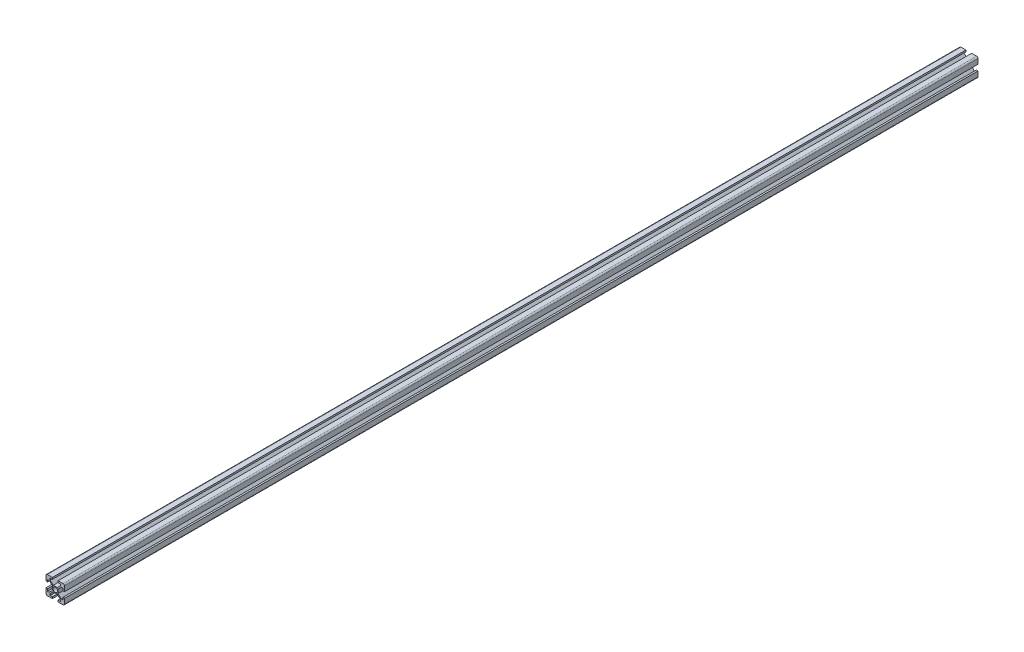
from build123d import *

# Parameters (mm, degrees)
SKETCH_1_R      = 2.5
EXTRUDE_1_DEPTH = 990


with BuildPart() as part:
    # 草图1 → 凸台-拉伸1 (new body)
    with BuildSketch(Plane.XY):
        with BuildLine():
            Line((-8.2, -3.1), (-10, -3.1))
            Line((-10, -3.1), (-10, -8.5))
            ThreePointArc((-10, -8.5), (-9.560660172, -9.560660172), (-8.5, -10))
            Line((-8.5, -10), (-3.1, -10))
            Line((-3.1, -10), (-3.1, -8.2))
            Line((-3.1, -8.2), (-5.5, -8.2))
            Line((-5.5, -8.2), (-5.5, -6.397050155))
            Line((-5.5, -6.397050155), (-2.202949845, -3.1))
            Line((-2.202949845, -3.1), (2.202949845, -3.1))
            Line((2.202949845, -3.1), (5.5, -6.397050155))
            Line((5.5, -6.397050155), (5.5, -8.2))
            Line((5.5, -8.2), (3.1, -8.2))
            Line((3.1, -8.2), (3.1, -10))
            Line((3.1, -10), (8.5, -10))
            ThreePointArc((8.5, -10), (9.560660172, -9.560660172), (10, -8.5))
            Line((10, -8.5), (10, -3.1))
            Line((10, -3.1), (8.2, -3.1))
            Line((8.2, -3.1), (8.2, -5.5))
            Line((8.2, -5.5), (6.397050155, -5.5))
            Line((6.397050155, -5.5), (3.05412702, -2.157076865))
            Line((3.05412702, -2.157076865), (3.05412702, 2.157076865))
            Line((3.05412702, 2.157076865), (6.397050155, 5.5))
            Line((6.397050155, 5.5), (8.2, 5.5))
            Line((8.2, 5.5), (8.2, 3.1))
            Line((8.2, 3.1), (10, 3.1))
            Line((10, 3.1), (10, 8.5))
            ThreePointArc((10, 8.5), (9.560660172, 9.560660172), (8.5, 10))
            Line((8.5, 10), (3.1, 10))
            Line((3.1, 10), (3.1, 8.2))
            Line((3.1, 8.2), (5.5, 8.2))
            Line((5.5, 8.2), (5.5, 6.397050155))
            Line((5.5, 6.397050155), (2.202949845, 3.1))
            Line((2.202949845, 3.1), (-2.202949845, 3.1))
            Line((-2.202949845, 3.1), (-5.5, 6.397050155))
            Line((-5.5, 6.397050155), (-5.5, 8.2))
            Line((-5.5, 8.2), (-3.1, 8.2))
            Line((-3.1, 8.2), (-3.1, 10))
            Line((-3.1, 10), (-8.5, 10))
            ThreePointArc((-8.5, 10), (-9.560660172, 9.560660172), (-10, 8.5))
            Line((-10, 8.5), (-10, 3.1))
            Line((-10, 3.1), (-8.2, 3.1))
            Line((-8.2, 3.1), (-8.2, 5.5))
            Line((-8.2, 5.5), (-6.397050155, 5.5))
            Line((-6.397050155, 5.5), (-3.05412702, 2.157076865))
            Line((-3.05412702, 2.157076865), (-3.05412702, -2.157076865))
            Line((-3.05412702, -2.157076865), (-6.397050155, -5.5))
            Line((-6.397050155, -5.5), (-8.2, -5.5))
            Line((-8.2, -5.5), (-8.2, -3.1))
        make_face()
        Circle(SKETCH_1_R, mode=Mode.SUBTRACT)
    extrude(amount=EXTRUDE_1_DEPTH)


solid = part.part
